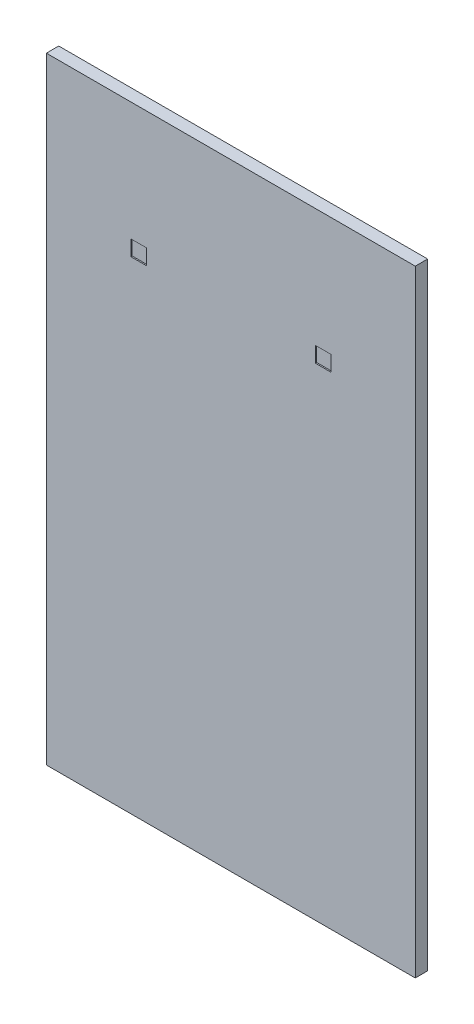
from build123d import *

# Parameters (mm, degrees)
SKETCH1_W           = 596
SKETCH1_H           = 996
BOSS_EXTRUDE1_DEPTH = 20
SKETCH2_W           = 25
SKETCH2_H           = 25
CUT_EXTRUDE1_DEPTH  = 2


with BuildPart() as part:
    # Sketch1 → Boss-Extrude1 (new body)
    with BuildSketch(Plane.XY):
        Rectangle(SKETCH1_W, SKETCH1_H)
    extrude(amount=BOSS_EXTRUDE1_DEPTH)

    # Sketch2 → Cut-Extrude1 (cut)
    with BuildSketch(Plane.XY.offset(20)):
        with Locations((149, 294)):
            Rectangle(SKETCH2_W, SKETCH2_H)
        with Locations((-149, 294)):
            Rectangle(SKETCH2_W, SKETCH2_H)
    extrude(amount=-CUT_EXTRUDE1_DEPTH, mode=Mode.SUBTRACT)


solid = part.part
